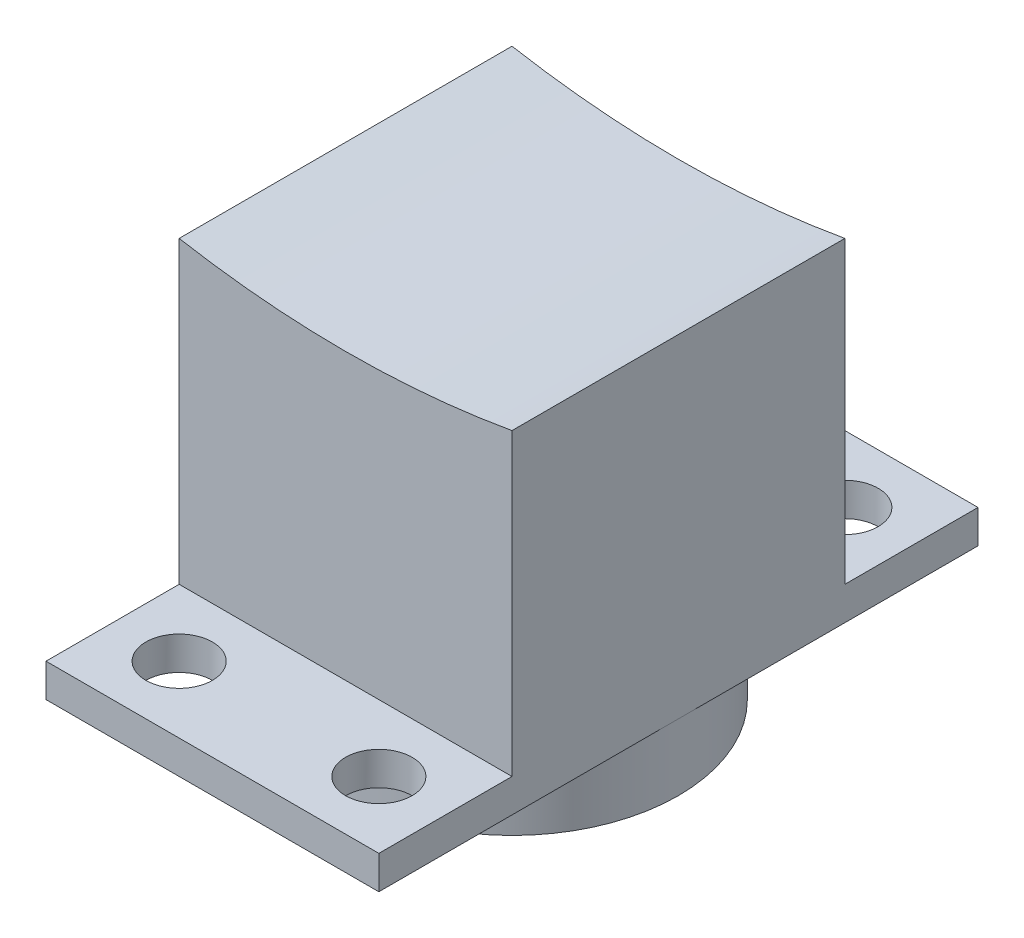
from build123d import *

# Parameters (mm, degrees)
BOSS_EXTRUDE1_DEPTH      = 50
SKETCH2_R                = 25
BOSS_EXTRUDE2_DEPTH      = 10
BOSS_EXTRUDE3_DEPTH      = 20
BOSS_EXTRUDE3_DEPTH_BACK = 70
SKETCH3_W                = 50
SKETCH3_H                = 5
SKETCH4_R                = 5
CUT_EXTRUDE1_DEPTH       = 10


with BuildPart() as part:
    # Sketch1 → Boss-Extrude1 (new body)
    with BuildSketch(Plane.XY):
        with BuildLine():
            Line((25, 25), (25, -25))
            Line((25, -25), (-25, -25))
            Line((-25, -25), (-25, 25))
            ThreePointArc((-25, 25), (0, 22.791003179), (25, 25))
        make_face()
    extrude(amount=BOSS_EXTRUDE1_DEPTH)

    # Sketch2 → Boss-Extrude2 (add)
    with BuildSketch(Plane.XZ.offset(25)):
        with Locations((0, 25)):
            Circle(SKETCH2_R)
    extrude(amount=BOSS_EXTRUDE2_DEPTH)

    # Sketch3 → Boss-Extrude3 (add, two sides: drawn at the far end of the back side and taken through both)
    with BuildSketch(Plane.XY.offset(50).offset(-BOSS_EXTRUDE3_DEPTH_BACK)):
        with Locations((0, -22.5)):
            Rectangle(SKETCH3_W, SKETCH3_H)
    extrude(amount=BOSS_EXTRUDE3_DEPTH + BOSS_EXTRUDE3_DEPTH_BACK)

    # Sketch4 → Cut-Extrude1 (cut)
    with BuildSketch(Plane(origin=(0, -20, 0), x_dir=(1, 0, 0), z_dir=(0, 1, 0))):
        with Locations(Location((-15, -60, 0), (0, 0, 270))):
            Circle(SKETCH4_R)
        with Locations(Location((15, -60, 0), (0, 0, 270))):
            Circle(SKETCH4_R)
        with Locations(Location((15, 10, 0), (0, 0, 270))):
            Circle(SKETCH4_R)
        with Locations(Location((-15, 10, 0), (0, 0, 270))):
            Circle(SKETCH4_R)
    extrude(amount=-CUT_EXTRUDE1_DEPTH, mode=Mode.SUBTRACT)


solid = part.part
